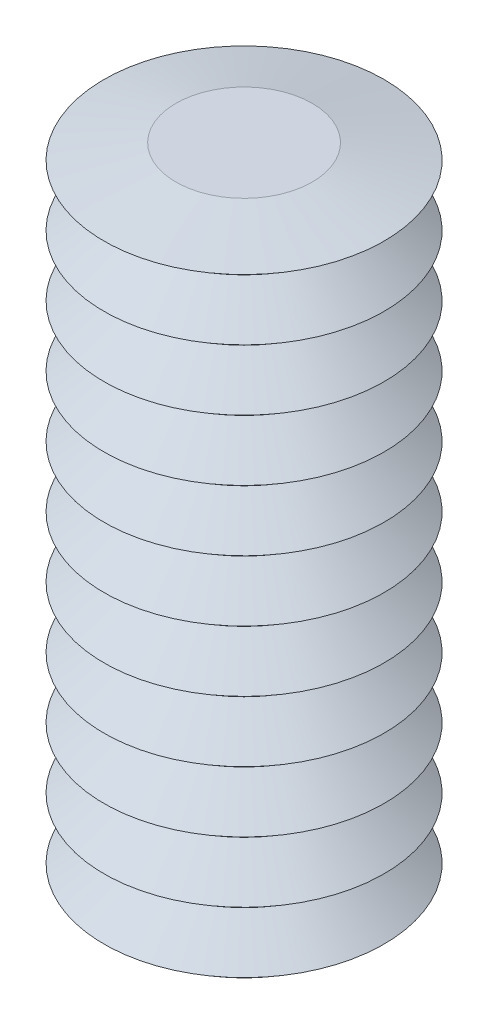
from build123d import *


with BuildPart() as part:
    # Sketch1 → Elemento_elastico_en_serie (revolve)
    with BuildSketch(Plane.XY, mode=Mode.PRIVATE) as elemento_elastico_en_serie_sk:
        Polygon((0, 0), (2.24, 0), (4.6, -0.5), (3.2, -1.5), (4.6, -2.5), (3.2, -3.5), (4.6, -4.5), (3.2, -5.5), (4.6, -6.5), (3.2, -7.5), (4.6, -8.5), (3.2, -9.5), (4.6, -10.5), (3.2, -11.5), (4.6, -12.5), (3.2, -13.5), (4.6, -14.5), (3.2, -15.5), (4.6, -16.5), (3.2, -17.5), (4.6, -18.5), (3.2, -19.5), (4.6, -20.5), (3.2, -21.5), (2.24, -22), (0, -22), align=None)
    revolve(elemento_elastico_en_serie_sk.sketch.rotate(Axis((0, -26, 0), (0, 1, 0)), 90), axis=Axis((0, -26, 0), (0, 1, 0)))


solid = part.part
